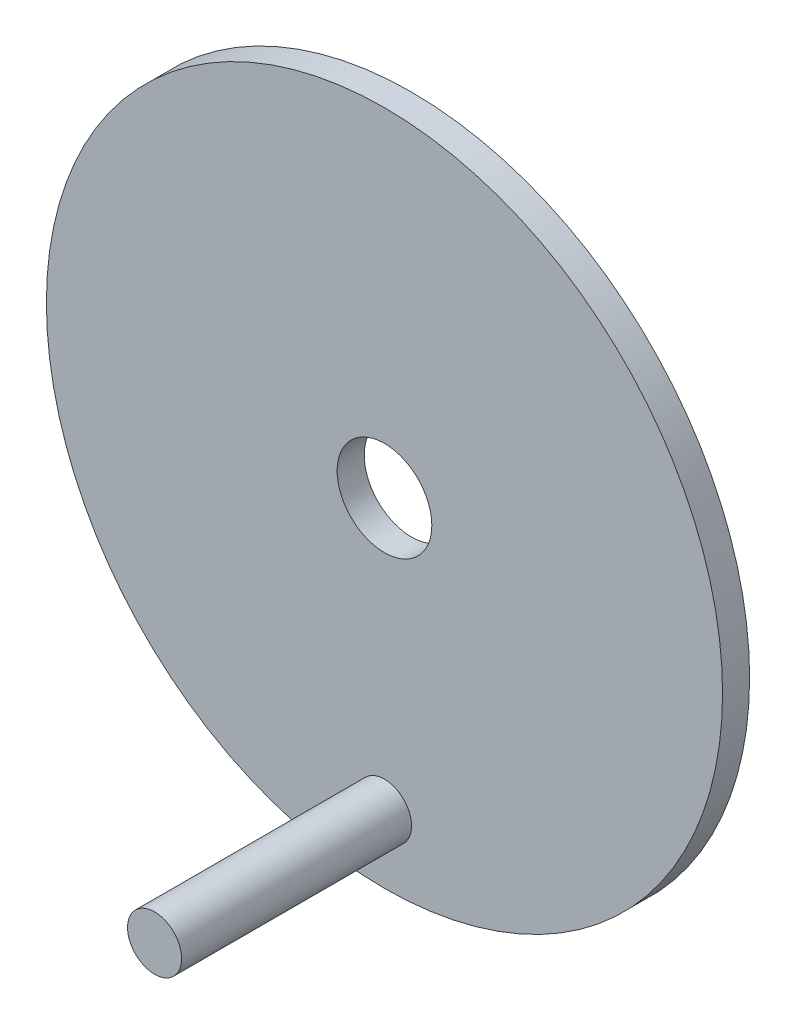
from build123d import *

# Parameters (mm, degrees)
IZIM1_R                     = 250
IZIM1_R_2                   = 35
Y_KSEKLIK_EKSTR_ZYON1_DEPTH = 20
IZIM2_R                     = 20
Y_KSEKLIK_EKSTR_ZYON2_DEPTH = 170


with BuildPart() as part:
    # Çizim1 → Yükseklik-Ekstrüzyon1 (new body)
    with BuildSketch(Plane.XY):
        Circle(IZIM1_R)
        Circle(IZIM1_R_2, mode=Mode.SUBTRACT)
    extrude(amount=Y_KSEKLIK_EKSTR_ZYON1_DEPTH)

    # Çizim2 → Yükseklik-Ekstrüzyon2 (add)
    with BuildSketch(Plane.XY.offset(20)):
        with Locations((0, -200)):
            Circle(IZIM2_R)
    extrude(amount=Y_KSEKLIK_EKSTR_ZYON2_DEPTH)


solid = part.part
